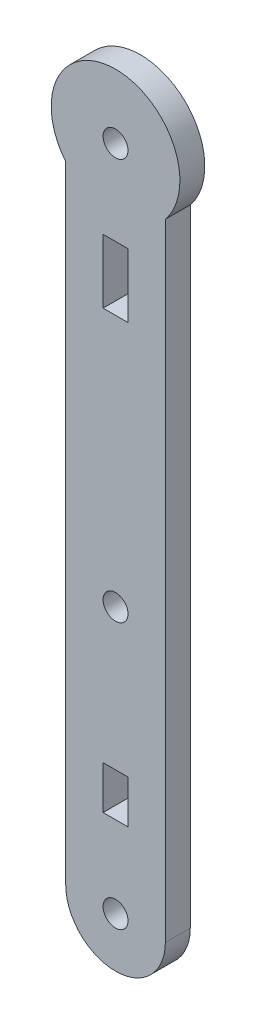
from build123d import *

# Parameters (mm, degrees)
ESQUISSE1_W        = 3
ESQUISSE1_H        = 5.2
ESQUISSE1_R        = 1.5
ESQUISSE1_H_2      = 7.7
BOSS_EXTRU_1_DEPTH = 3


with BuildPart() as part:
    # Esquisse1 → Boss.-Extru.1 (new body)
    with BuildSketch(Plane.XY):
        with BuildLine():
            ThreePointArc((771.396898563, 207.86630439), (765.396898563, 220.521658607), (759.396898563, 207.86630439))
            Line((759.396898563, 207.86630439), (759.396898563, 132.443292949))
            ThreePointArc((759.396898563, 132.443292949), (765.396898563, 126.443292949), (771.396898563, 132.443292949))
            Line((771.396898563, 132.443292949), (771.396898563, 207.86630439))
        make_face()
        with Locations((765.396898563, 144.843292949)):
            Rectangle(ESQUISSE1_W, ESQUISSE1_H, mode=Mode.SUBTRACT)
        with Locations((765.396898563, 132.443292949)):
            Circle(ESQUISSE1_R, mode=Mode.SUBTRACT)
        with Locations((765.396898563, 164.443292949)):
            Circle(ESQUISSE1_R, mode=Mode.SUBTRACT)
        with Locations((765.396898563, 198.693292949)):
            Rectangle(ESQUISSE1_W, ESQUISSE1_H_2, mode=Mode.SUBTRACT)
        with Locations((765.396898563, 212.771658607)):
            Circle(ESQUISSE1_R, mode=Mode.SUBTRACT)
    extrude(amount=BOSS_EXTRU_1_DEPTH)


solid = part.part
